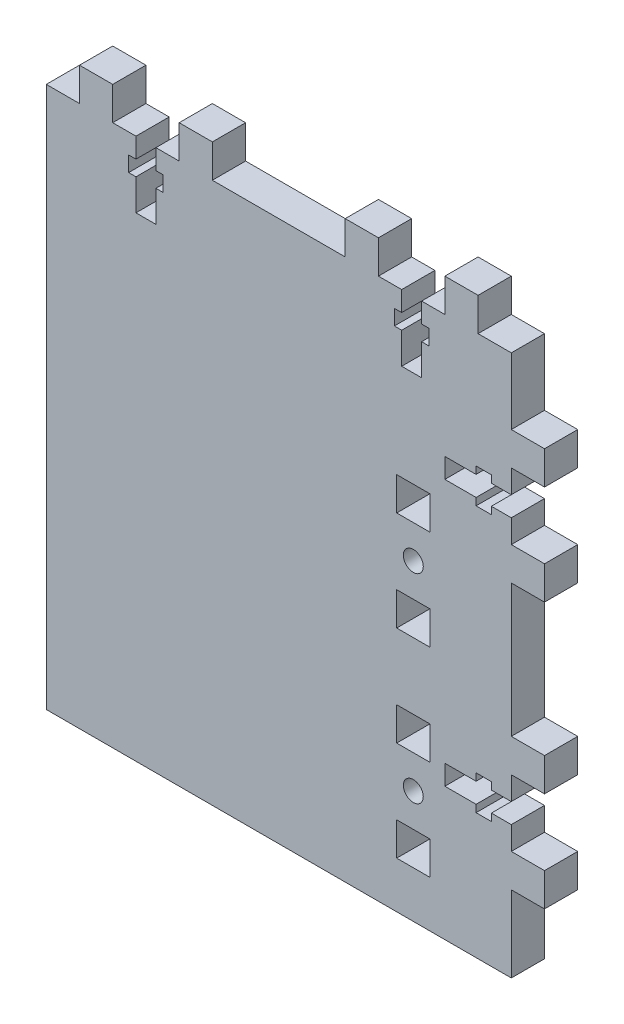
from build123d import *

# Parameters (mm, degrees)
SKETCH1_R           = 1.5
SKETCH1_W           = 5
SKETCH1_H           = 5
BOSS_EXTRUDE1_DEPTH = 5


with BuildPart() as part:
    # Sketch1 → Boss-Extrude1 (new body)
    with BuildSketch(Plane.XY):
        Polygon((70, 81.5), (70, 71.5), (75, 71.5), (75, 66.5), (70, 66.5), (70, 63), (67, 63), (67, 64.1), (64.7, 64.1), (64.7, 63), (60, 63), (60, 60), (64.7, 60), (64.7, 58.9), (67, 58.9), (67, 60), (70, 60), (70, 56.5), (75, 56.5), (75, 51.5), (70, 51.5), (70, 31.5), (75, 31.5), (75, 26.5), (70, 26.5), (70, 23), (67, 23), (67, 24.1), (64.7, 24.1), (64.7, 23), (60, 23), (60, 20), (64.7, 20), (64.7, 18.9), (67, 18.9), (67, 20), (70, 20), (70, 16.5), (75, 16.5), (75, 11.5), (70, 11.5), (70, 0), (0, 0), (0, 81.5), (5, 81.5), (5, 86.5), (10, 86.5), (10, 81.5), (13.5, 81.5), (13.5, 78.5), (12.4, 78.5), (12.4, 76.2), (13.5, 76.2), (13.5, 71.5), (16.5, 71.5), (16.5, 76.2), (17.6, 76.2), (17.6, 78.5), (16.5, 78.5), (16.5, 81.5), (20, 81.5), (20, 86.5), (25, 86.5), (25, 81.5), (45, 81.5), (45, 86.5), (50, 86.5), (50, 81.5), (53.5, 81.5), (53.5, 78.5), (52.4, 78.5), (52.4, 76.2), (53.5, 76.2), (53.5, 71.5), (56.5, 71.5), (56.5, 76.2), (57.6, 76.2), (57.6, 78.5), (56.5, 78.5), (56.5, 81.5), (60, 81.5), (60, 86.5), (65, 86.5), (65, 81.5), align=None)
        with Locations((55.25, 47)):
            Circle(SKETCH1_R, mode=Mode.SUBTRACT)
        with Locations((55.25, 17)):
            Circle(SKETCH1_R, mode=Mode.SUBTRACT)
        with Locations((55.25, 39.5)):
            Rectangle(SKETCH1_W, SKETCH1_H, mode=Mode.SUBTRACT)
        with Locations((55.25, 54.5)):
            Rectangle(SKETCH1_W, SKETCH1_H, mode=Mode.SUBTRACT)
        with Locations((55.25, 9.5)):
            Rectangle(SKETCH1_W, SKETCH1_H, mode=Mode.SUBTRACT)
        with Locations((55.25, 24.5)):
            Rectangle(SKETCH1_W, SKETCH1_H, mode=Mode.SUBTRACT)
    extrude(amount=BOSS_EXTRUDE1_DEPTH)


solid = part.part
